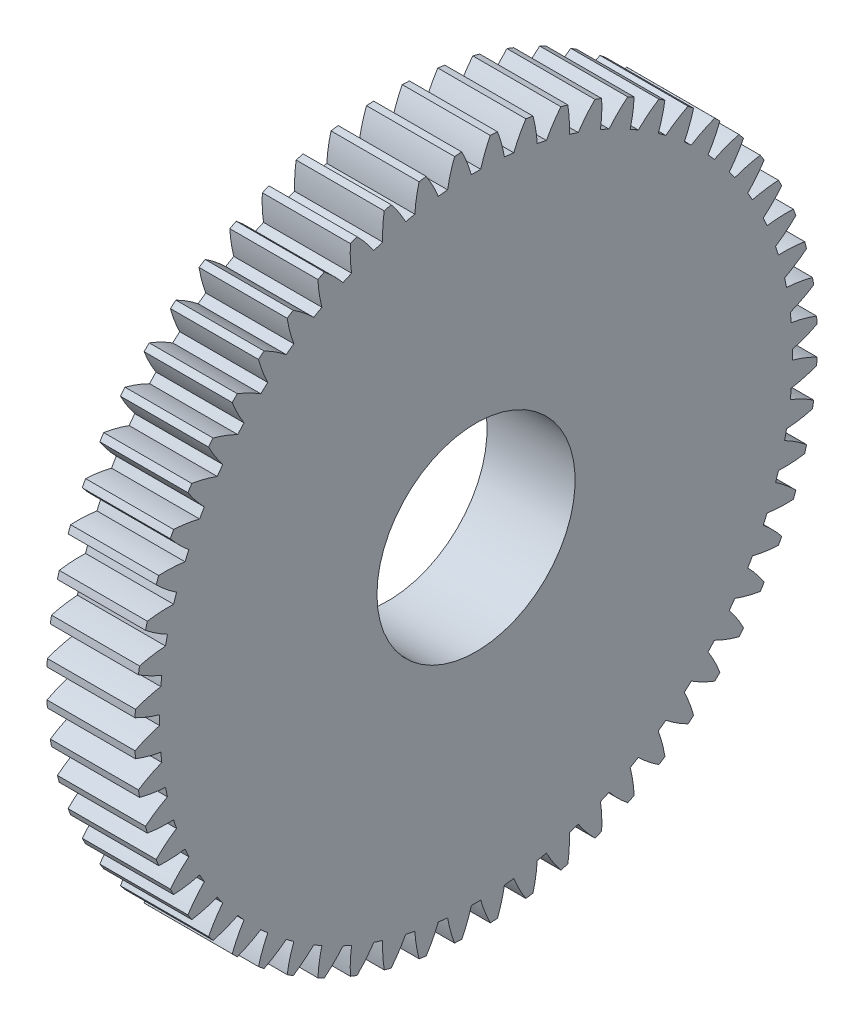
from build123d import *

# Parameters (mm, degrees)
BASPROSKE_W        = 10
BASPROSKE_H        = 38.75
TOOTHCUT_DEPTH     = 56.705699888
TEETHCUTS_COUNT    = 60
TEETHCUTS_ANGLE    = 354
HUBNEAONESKE_R     = 5
HUBNEARONE_DEPTH   = 5.0000508
BORSKE_R           = 8.5
BORE_DEPTH         = 10.0000508
SKETCH1_R          = 11.25
CUT_EXTRUDE1_DEPTH = 10


with BuildPart() as part:
    # BasProSke → Base-Revolve (revolve)
    with BuildSketch(Plane(origin=(0, 0, 0), x_dir=(1, 0, 0), z_dir=(0, 1, 0)), mode=Mode.PRIVATE) as base_revolve_sk:
        with Locations((5, 19.375)):
            Rectangle(BASPROSKE_W, BASPROSKE_H)
    revolve(base_revolve_sk.sketch.rotate(Axis((-10, 0, 0), (1, 0, 0)), 180), axis=Axis((-10, 0, 0), (1, 0, 0)))

    # TooCutSke → ToothCut (cut, through all)
    with BuildSketch(Plane(origin=(0, 0, 0), x_dir=(0, 0, -1), z_dir=(1, 0, 0))):
        with BuildLine():
            ThreePointArc((0.53356623, 35.932538726), (0, 35.9365), (-0.53356623, 35.932538726))
            ThreePointArc((-0.53356623, 35.932538726), (-1.012587985, 37.364472092), (-1.6331416, 38.74099242))
            ThreePointArc((-1.6331416, 38.74099242), (0, 38.7754), (1.6331416, 38.74099242))
            ThreePointArc((1.6331416, 38.74099242), (1.012587985, 37.364472092), (0.53356623, 35.932538726))
        make_face()
    toothcut = extrude(amount=TOOTHCUT_DEPTH, mode=Mode.SUBTRACT)

    # TeethCuts: ToothCut ×60 about axis
    teethcuts_axis = Axis((-10, 0, 0), (1, 0, 0))
    for i in range(1, TEETHCUTS_COUNT):
        add(toothcut.rotate(teethcuts_axis, i * TEETHCUTS_ANGLE / (TEETHCUTS_COUNT - 1)), mode=Mode.SUBTRACT)

    # HubNeaOneSke → HubNearOne (add)
    with BuildSketch(Plane.ZY):
        with Locations(Location((0, 0, 0), (0, 0, 180))):
            Circle(HUBNEAONESKE_R)
    extrude(amount=HUBNEARONE_DEPTH)

    # BorSke → Bore (cut, symmetric)
    with BuildSketch(Plane(origin=(0, 0, 0), x_dir=(0, 0, -1), z_dir=(1, 0, 0))):
        with Locations(Location((0, 0, 0), (0, 0, 180))):
            Circle(BORSKE_R)
    extrude(amount=BORE_DEPTH, both=True, mode=Mode.SUBTRACT)

    # Sketch1 → Cut-Extrude1 (cut)
    with BuildSketch(Plane.ZY):
        Circle(SKETCH1_R)
    extrude(amount=-CUT_EXTRUDE1_DEPTH, mode=Mode.SUBTRACT)


solid = part.part
